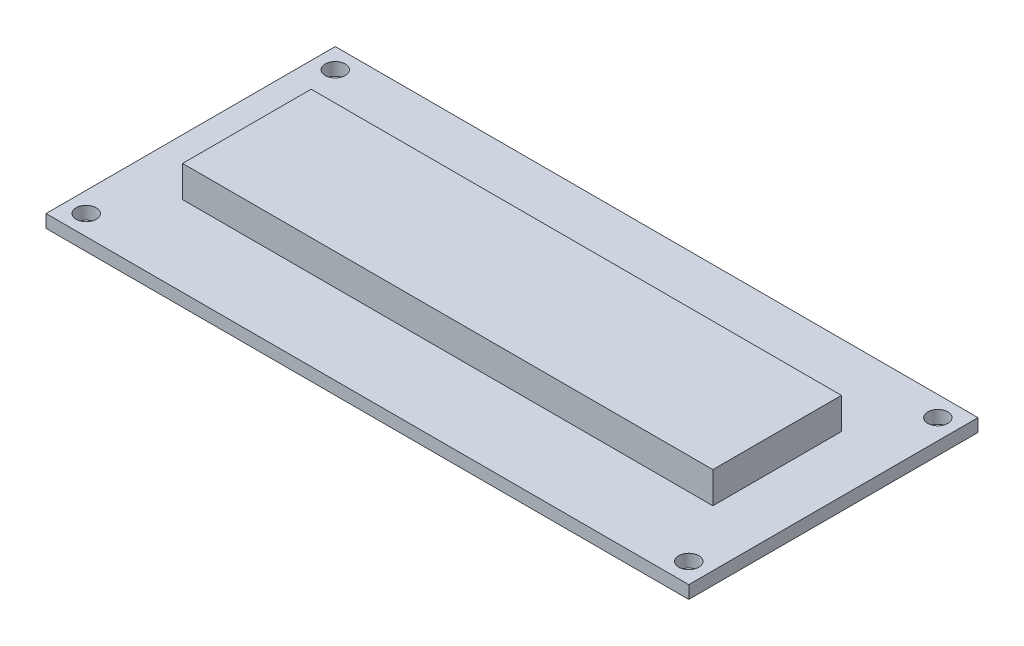
from build123d import *

# Parameters (mm, degrees)
SKETCH1_W               = 80
SKETCH1_H               = 36
BOSS_EXTRUDE1_DEPTH     = 1.6
SKETCH3_W               = 66
SKETCH3_H               = 16
BOSS_EXTRUDE2_DEPTH     = 3.9
SKETCH4_R               = 1.25
CUT_EXTRUDE1_DEPTH      = 4.9
MIRROR3_COPY_1_SKETCH_R = 1.25
MIRROR3_COPY_1_DEPTH    = 4.9


with BuildPart() as part:
    # Sketch1 → Boss-Extrude1 (new body)
    with BuildSketch(Plane(origin=(0, 0, 0), x_dir=(1, 0, 0), z_dir=(0, 1, 0))):
        Rectangle(SKETCH1_W, SKETCH1_H)
    extrude(amount=BOSS_EXTRUDE1_DEPTH)

    # Sketch3 → Boss-Extrude2 (add)
    with BuildSketch(Plane(origin=(0, 1.6, 0), x_dir=(1, 0, 0), z_dir=(0, 1, 0))):
        Rectangle(SKETCH3_W, SKETCH3_H)
    extrude(amount=BOSS_EXTRUDE2_DEPTH)

    # Sketch4 → Cut-Extrude1 (cut)
    with BuildSketch(Plane(origin=(0, 1.6, 0), x_dir=(1, 0, 0), z_dir=(0, 1, 0))):
        with Locations(Location((-37.5, 15.5, 0), (0, 0, 270))):
            Circle(SKETCH4_R)
    cut_extrude1 = extrude(amount=-CUT_EXTRUDE1_DEPTH, mode=Mode.SUBTRACT)

    # Mirror2: Cut-Extrude1 across plane
    add(cut_extrude1.mirror(Plane.ZY), mode=Mode.SUBTRACT)

    # Mirror3: Cut-Extrude1 across plane
    add(cut_extrude1.mirror(Plane.XY), mode=Mode.SUBTRACT)

    # Mirror3 copy 1 sketch → Mirror3 copy 1 (cut)
    with BuildSketch(Plane(origin=(0, 1.6, 0), x_dir=(-1, 0, 0), z_dir=(0, 1, 0))):
        with Locations(Location((-37.5, 15.5, 0), (0, 0, 270))):
            Circle(MIRROR3_COPY_1_SKETCH_R)
    extrude(amount=-MIRROR3_COPY_1_DEPTH, mode=Mode.SUBTRACT)


solid = part.part
